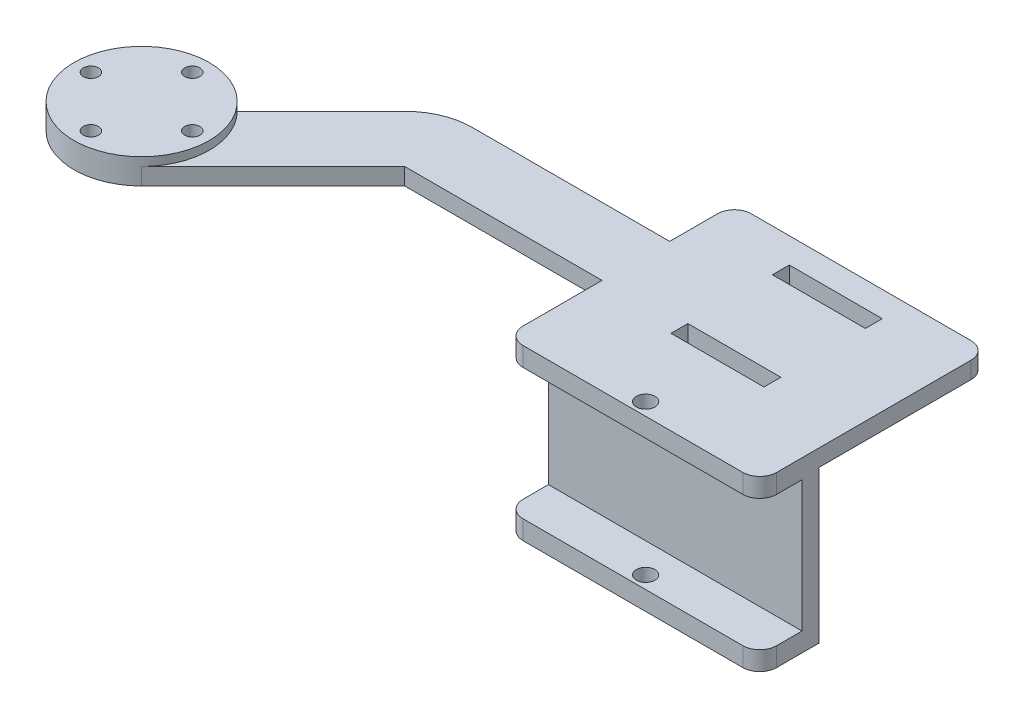
from build123d import *

# Parameters (mm, degrees)
SKETCH_1_W               = 30
SKETCH_1_H               = 7
EXTRUDE_1_DEPTH          = 20
SKETCH_2_W               = 30
SKETCH_2_H               = 15.5
CUT_EXTRUDE_1_DEPTH      = 5
CUT_EXTRUDE_2_DEPTH      = 37.728735344
CUT_EXTRUDE_2_DEPTH_BACK = 37.728735344
SKETCH_4_R               = 1.1
SKETCH_5_W               = 30
SKETCH_5_H               = 2
EXTRUDE_2_DEPTH          = 20
SKETCH_6_W               = 11
SKETCH_6_H               = 2
CUT_EXTRUDE_3_DEPTH      = 2
EXTRUDE_3_DEPTH          = 2
SKETCH_8_R               = 8
EXTRUDE_4_DEPTH          = 3
CUT_EXTRUDE_4_REACH      = 62.033
SKETCH_10_R              = 0.9
FILLET_1_R               = 2


with BuildPart() as part:
    # 草图1 → 凸台-拉伸1 (new body)
    with BuildSketch(Plane(origin=(0, 0, 0), x_dir=(1, 0, 0), z_dir=(0, 1, 0))):
        with Locations((15, -3.5)):
            Rectangle(SKETCH_1_W, SKETCH_1_H)
    extrude(amount=EXTRUDE_1_DEPTH)

    # 草图2 → 切除-拉伸1 (cut)
    with BuildSketch(Plane.XY.offset(7)):
        with Locations((15, 10)):
            Rectangle(SKETCH_2_W, SKETCH_2_H)
    extrude(amount=-CUT_EXTRUDE_1_DEPTH, mode=Mode.SUBTRACT)

    # 草图4 → 切除-拉伸2 (cut, two sides: drawn at the far end of the back side and taken through both)
    with BuildSketch(Plane(origin=(0, 20, 0), x_dir=(1, 0, 0), z_dir=(0, 1, 0)).offset(-CUT_EXTRUDE_2_DEPTH_BACK)):
        with Locations(Location((15, -5.5, 0), (0, 0, 270))):
            Circle(SKETCH_4_R)
    extrude(amount=CUT_EXTRUDE_2_DEPTH + CUT_EXTRUDE_2_DEPTH_BACK, mode=Mode.SUBTRACT)

    # 草图5 → 凸台-拉伸2 (add)
    with BuildSketch(Plane(origin=(0, 0, 0), x_dir=(-1, 0, 0), z_dir=(0, 0, -1))):
        with Locations((-15, 19)):
            Rectangle(SKETCH_5_W, SKETCH_5_H)
    extrude(amount=EXTRUDE_2_DEPTH)

    # 草图6 → 切除-拉伸3 (cut)
    with BuildSketch(Plane(origin=(0, 20, 0), x_dir=(1, 0, 0), z_dir=(0, 1, 0))):
        with Locations((15, 16)):
            Rectangle(SKETCH_6_W, SKETCH_6_H)
        with Locations((15, 4)):
            Rectangle(SKETCH_6_W, SKETCH_6_H)
    extrude(amount=-CUT_EXTRUDE_3_DEPTH, mode=Mode.SUBTRACT)

    # 草图7 → 凸台-拉伸3 (add)
    with BuildSketch(Plane.XZ.offset(-18)):
        with BuildLine():
            Line((0, -12.343145751), (0, -10))
            Line((0, -10), (0, -4.343145751))
            Line((0, -4.343145751), (-23.343145751, -4.343145751))
            Line((-23.343145751, -4.343145751), (-38.907528162, 11.221236661))
            Line((-38.907528162, 11.221236661), (-44.564382411, 5.564382411))
            Line((-44.564382411, 5.564382411), (-29, -10))
            ThreePointArc((-29, -10), (-26.404613209, -11.734182011), (-23.343145751, -12.343145751))
            Line((-23.343145751, -12.343145751), (0, -12.343145751))
        make_face()
    extrude(amount=-EXTRUDE_3_DEPTH)

    # 草图8 → 凸台-拉伸4 (add)
    with BuildSketch(Plane.XZ.offset(-18)):
        with Locations(Location((-44.564382411, 5.564382411, 0), (0, 0, 270))):
            Circle(SKETCH_8_R)
    extrude(amount=-EXTRUDE_4_DEPTH)

    # 草图10 → 切除-拉伸4 (cut, up to next)
    with BuildSketch(Plane(origin=(0, 21, 0), x_dir=(1, 0, 0), z_dir=(0, 1, 0)), mode=Mode.PRIVATE) as cut_extrude_4_sk1:
        with Locations(Location((-38.564382411, -5.564382411, 0), (0, 0, 270))):
            Circle(SKETCH_10_R)
    cut_extrude_4_tool1 = extrude(cut_extrude_4_sk1.sketch, amount=-CUT_EXTRUDE_4_REACH, mode=Mode.PRIVATE) & part.part
    # 草图10 → 切除-拉伸4 (cut, up to next)
    with BuildSketch(Plane(origin=(0, 21, 0), x_dir=(1, 0, 0), z_dir=(0, 1, 0)), mode=Mode.PRIVATE) as cut_extrude_4_sk2:
        with Locations(Location((-44.564382411, -11.564382411, 0), (0, 0, 270))):
            Circle(SKETCH_10_R)
    cut_extrude_4_tool2 = extrude(cut_extrude_4_sk2.sketch, amount=-CUT_EXTRUDE_4_REACH, mode=Mode.PRIVATE) & part.part
    # 草图10 → 切除-拉伸4 (cut, up to next)
    with BuildSketch(Plane(origin=(0, 21, 0), x_dir=(1, 0, 0), z_dir=(0, 1, 0)), mode=Mode.PRIVATE) as cut_extrude_4_sk3:
        with Locations(Location((-50.564382411, -5.564382411, 0), (0, 0, 270))):
            Circle(SKETCH_10_R)
    cut_extrude_4_tool3 = extrude(cut_extrude_4_sk3.sketch, amount=-CUT_EXTRUDE_4_REACH, mode=Mode.PRIVATE) & part.part
    # 草图10 → 切除-拉伸4 (cut, up to next)
    with BuildSketch(Plane(origin=(0, 21, 0), x_dir=(1, 0, 0), z_dir=(0, 1, 0)), mode=Mode.PRIVATE) as cut_extrude_4_sk4:
        with Locations(Location((-44.564382411, 0.435617589, 0), (0, 0, 270))):
            Circle(SKETCH_10_R)
    cut_extrude_4_tool4 = extrude(cut_extrude_4_sk4.sketch, amount=-CUT_EXTRUDE_4_REACH, mode=Mode.PRIVATE) & part.part
    add(cut_extrude_4_tool1.solids().sort_by_distance((-38.564382, 21, 5.564382))[0], mode=Mode.SUBTRACT)
    add(cut_extrude_4_tool2.solids().sort_by_distance((-44.564382, 21, 11.564382))[0], mode=Mode.SUBTRACT)
    add(cut_extrude_4_tool3.solids().sort_by_distance((-50.564382, 21, 5.564382))[0], mode=Mode.SUBTRACT)
    add(cut_extrude_4_tool4.solids().sort_by_distance((-44.564382, 21, -0.435618))[0], mode=Mode.SUBTRACT)

    # 圆角1
    fillet_1_edges = [part.edges().sort_by_distance(p)[0] for p in [
        (30, 1.125, 7),
        (0, 1.125, 7),
        (30, 19, -20),
        (0, 19, -20),
        (30, 18.875, 7),
        (0, 18.875, 7),
    ]]
    fillet(fillet_1_edges, radius=FILLET_1_R)


solid = part.part
